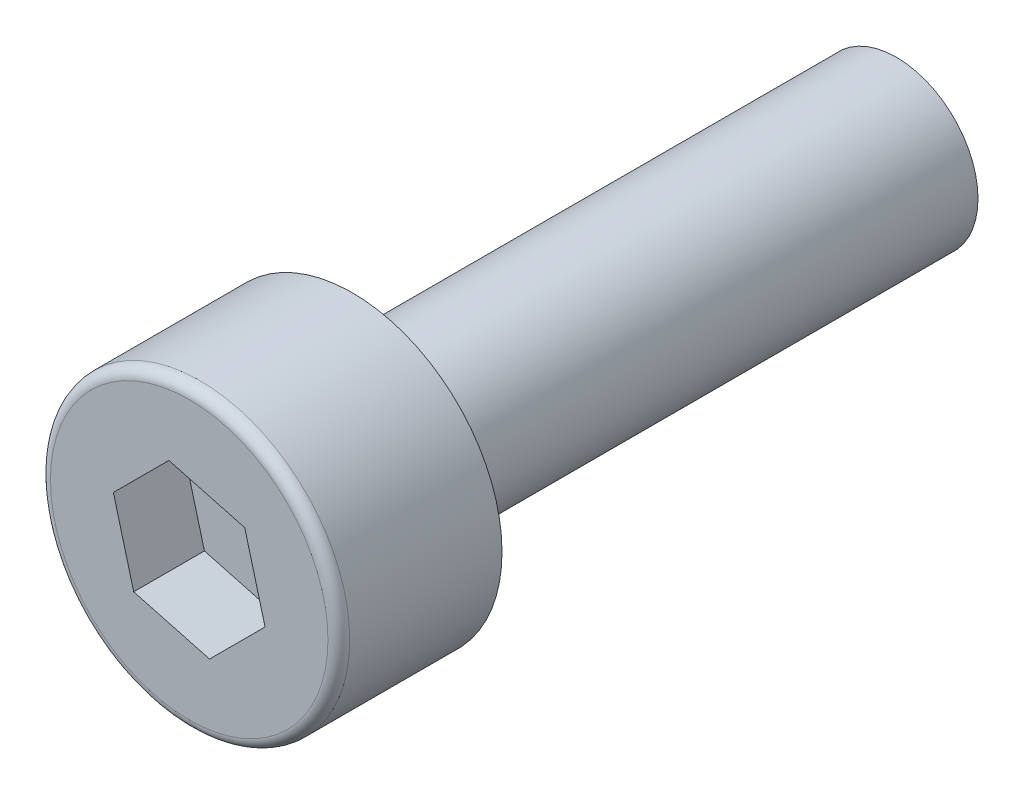
from build123d import *

# Parameters (mm, degrees)
SKETCH_1_R          = 2.75
EXTRUDE_1_DEPTH     = 3
CUT_EXTRUDE_1_DEPTH = 1.3
SKETCH_3_R          = 1.5
EXTRUDE_2_DEPTH     = 10
FILLET_1_R          = 0.2


with BuildPart() as part:
    # 草图1 → 凸台-拉伸1 (new body)
    with BuildSketch(Plane.XY):
        Circle(SKETCH_1_R)
    extrude(amount=EXTRUDE_1_DEPTH)

    # 草图2 → 切除-拉伸1 (cut)
    with BuildSketch(Plane.XY.offset(3)):
        Polygon((-1.020620726, -1.020620726), (0.373573113, -1.39419384), (1.39419384, -0.373573113), (1.020620726, 1.020620726), (-0.373573113, 1.39419384), (-1.39419384, 0.373573113), align=None)
    extrude(amount=-CUT_EXTRUDE_1_DEPTH, mode=Mode.SUBTRACT)

    # 草图3 → 凸台-拉伸2 (add)
    with BuildSketch(Plane(origin=(0, 0, 0), x_dir=(-1, 0, 0), z_dir=(0, 0, -1))):
        with Locations(Location((0, 0, 0), (0, 0, 180))):
            Circle(SKETCH_3_R)
    extrude(amount=EXTRUDE_2_DEPTH)

    # 圆角1
    fillet_1_edges = [part.edges().sort_by_distance(p)[0] for p in [
        (-2.75, 0, 3),
    ]]
    fillet(fillet_1_edges, radius=FILLET_1_R)


solid = part.part
